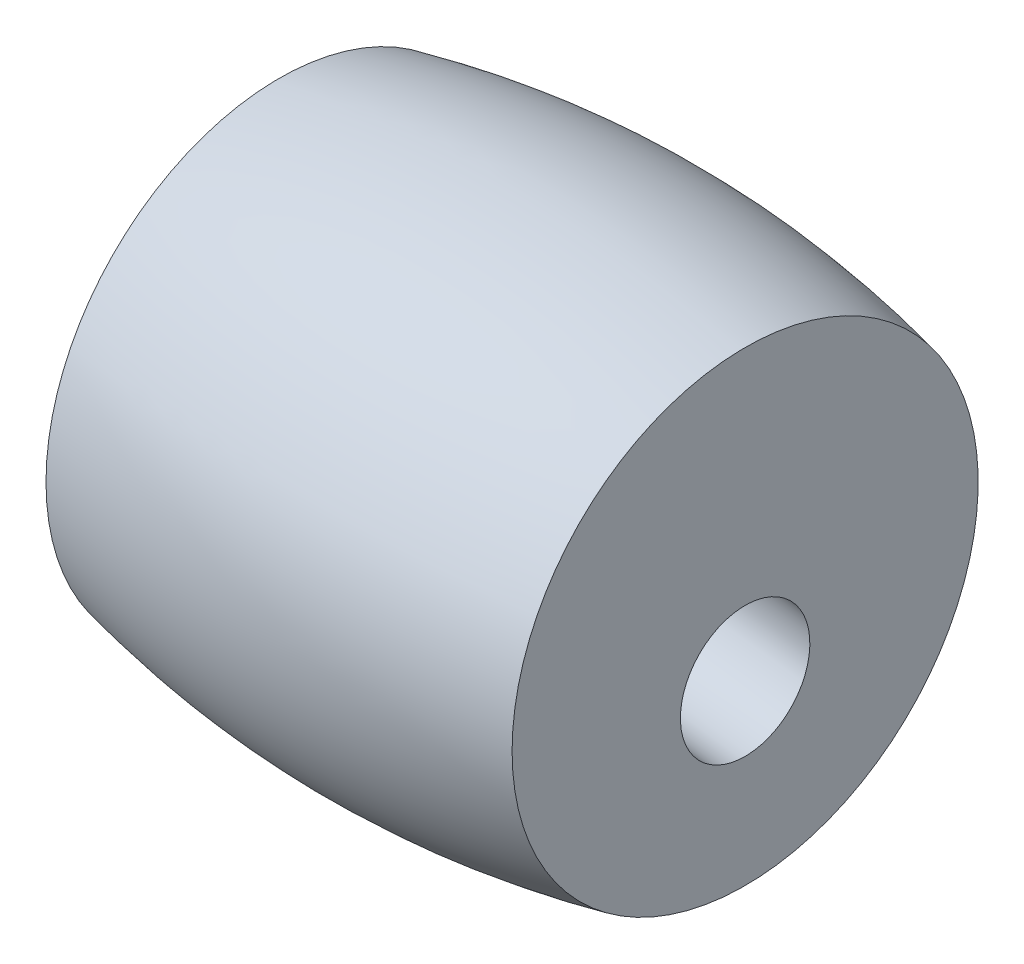
from build123d import *

# Parameters (mm, degrees)
SKETCH_3_R = 2.5


with BuildPart() as part:
    # 草图1 → 旋转1 (revolve)
    with BuildSketch(Plane.XY):
        with BuildLine():
            Line((-9, 74), (-9, 65))
            Line((-9, 65), (9, 65))
            Line((9, 65), (9, 74))
            add(Edge.make_bspline(
                [(-9, 74), (0, 76), (9, 74)],
                knots=[0, 0, 0, 1, 1, 1], degree=2))
        make_face()
    revolve(axis=Axis((-1000, 65, 0), (1, 0, 0)))

    # 切除-扫描1: sweep along a path in 草图2
    with BuildLine(Plane.XY) as sweep_1_path:
        CenterArc((0, 0), 65, 0, 360)
    # 草图3 → 切除-扫描1 (sweep, cut)
    with BuildSketch(Plane(origin=(0, 0, 0), x_dir=(1, 0, 0), z_dir=(0, 1, 0))):
        with Locations((-63.490505487, 0)):
            Circle(SKETCH_3_R)
    sweep(path=sweep_1_path.line, mode=Mode.SUBTRACT)


solid = part.part
